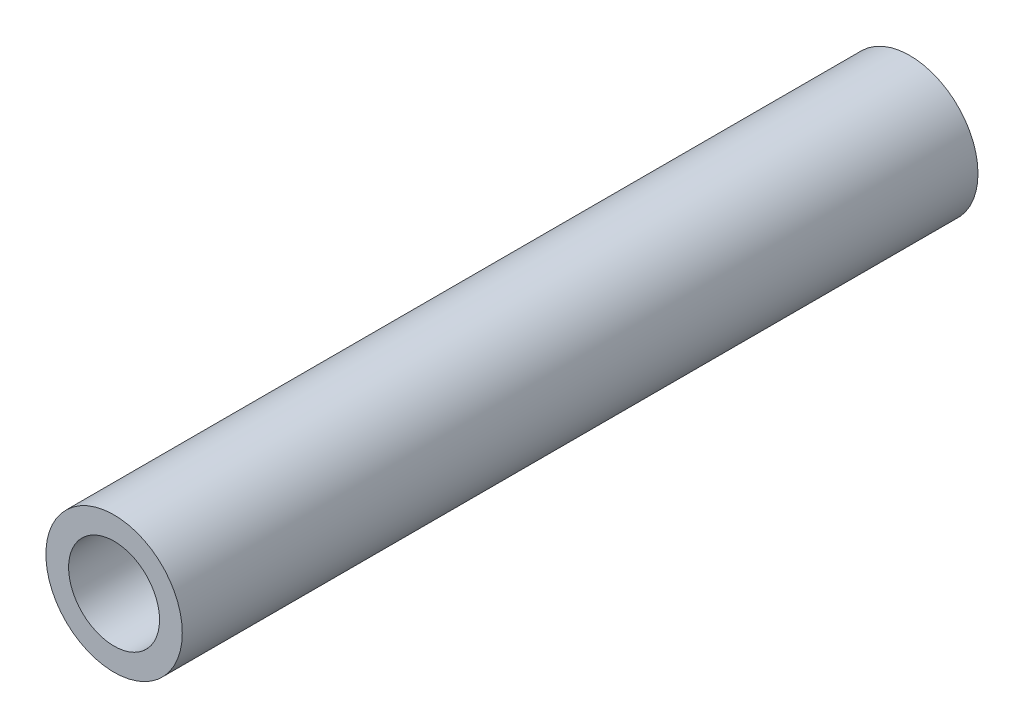
from build123d import *

# Parameters (mm, degrees)
SKETCH_1_R      = 3
SKETCH_1_R_2    = 2
EXTRUDE_1_DEPTH = 35


with BuildPart() as part:
    # ｽｹｯﾁ1 → ﾎﾞｽ - 押し出し1 (new body)
    with BuildSketch(Plane.XY):
        Circle(SKETCH_1_R)
        Circle(SKETCH_1_R_2, mode=Mode.SUBTRACT)
    extrude(amount=EXTRUDE_1_DEPTH)


solid = part.part
